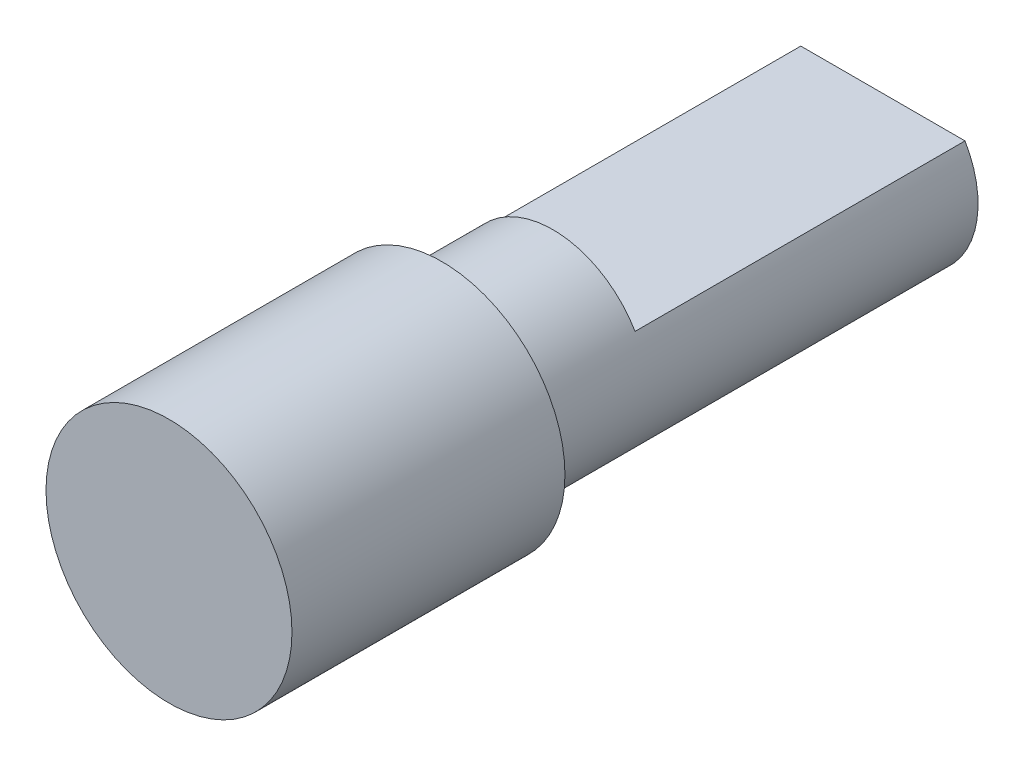
from build123d import *

# Parameters (mm, degrees)
SKETCH2_R           = 4.1
BOSS_EXTRUDE1_DEPTH = 9.1
SKETCH3_R           = 3.1725
BOSS_EXTRUDE2_DEPTH = 14.7
CUT_EXTRUDE1_START  = -11
CUT_EXTRUDE1_DEPTH  = 11


with BuildPart() as part:
    # Sketch2 → Boss-Extrude1 (new body)
    with BuildSketch(Plane.XY):
        Circle(SKETCH2_R)
    extrude(amount=BOSS_EXTRUDE1_DEPTH)

    # Sketch3 → Boss-Extrude2 (add)
    with BuildSketch(Plane(origin=(0, 0, 0), x_dir=(-1, 0, 0), z_dir=(0, 0, -1))):
        Circle(SKETCH3_R)
    extrude(amount=BOSS_EXTRUDE2_DEPTH)

    # Sketch4 → Cut-Extrude1 (cut)
    with BuildSketch(Plane(origin=(0, 0, -14.7), x_dir=(-1, 0, 0), z_dir=(0, 0, -1)).offset(CUT_EXTRUDE1_START)):
        with BuildLine():
            Line((-2.737651106, 1.603129026), (2.737651106, 1.603129026))
            ThreePointArc((2.737651106, 1.603129026), (0, 3.1725), (-2.737651106, 1.603129026))
        make_face()
    extrude(amount=CUT_EXTRUDE1_DEPTH, mode=Mode.SUBTRACT)


solid = part.part
